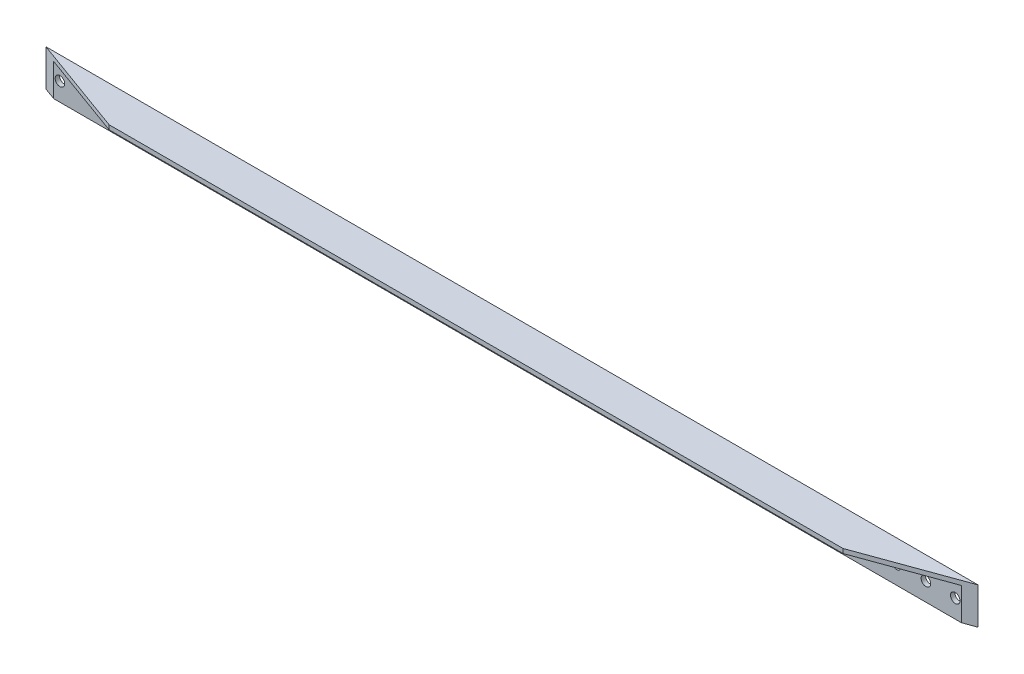
from build123d import *

# Parameters (mm, degrees)
SKETCH_1_W          = 2540
SKETCH_1_H          = 100
SKETCH_1_R          = 13
EXTRUDE_523_DEPTH   = 12
SKETCH_2_W          = 2540
SKETCH_2_H          = 12
EXTRUDE_1_DEPTH     = 86
CUT_EXTRUDE_1_DEPTH = 1278.694799238


with BuildPart() as part:
    # 草图1 → Extrude 523 (new body)
    with BuildSketch(Plane.XY):
        Rectangle(SKETCH_1_W, SKETCH_1_H)
        with Locations((1220, 0)):
            Circle(SKETCH_1_R, mode=Mode.SUBTRACT)
        with Locations((1140, 0)):
            Circle(SKETCH_1_R, mode=Mode.SUBTRACT)
        with Locations((1060, 0)):
            Circle(SKETCH_1_R, mode=Mode.SUBTRACT)
        with Locations((980, 0)):
            Circle(SKETCH_1_R, mode=Mode.SUBTRACT)
        with Locations((580, 0)):
            Circle(SKETCH_1_R, mode=Mode.SUBTRACT)
        with Locations((460, 0)):
            Circle(SKETCH_1_R, mode=Mode.SUBTRACT)
        with Locations((380, 0)):
            Circle(SKETCH_1_R, mode=Mode.SUBTRACT)
        with Locations((300, 0)):
            Circle(SKETCH_1_R, mode=Mode.SUBTRACT)
        with Locations((180, 0)):
            Circle(SKETCH_1_R, mode=Mode.SUBTRACT)
        with Locations(Location((-180, 0, 0), (0, 0, 180))):
            Circle(SKETCH_1_R, mode=Mode.SUBTRACT)
        with Locations(Location((-300, 0, 0), (0, 0, 180))):
            Circle(SKETCH_1_R, mode=Mode.SUBTRACT)
        with Locations(Location((-380, 0, 0), (0, 0, 180))):
            Circle(SKETCH_1_R, mode=Mode.SUBTRACT)
        with Locations(Location((-460, 0, 0), (0, 0, 180))):
            Circle(SKETCH_1_R, mode=Mode.SUBTRACT)
        with Locations(Location((-580, 0, 0), (0, 0, 180))):
            Circle(SKETCH_1_R, mode=Mode.SUBTRACT)
        with Locations(Location((-980, 0, 0), (0, 0, 180))):
            Circle(SKETCH_1_R, mode=Mode.SUBTRACT)
        with Locations(Location((-1060, 0, 0), (0, 0, 180))):
            Circle(SKETCH_1_R, mode=Mode.SUBTRACT)
        with Locations(Location((-1140, 0, 0), (0, 0, 180))):
            Circle(SKETCH_1_R, mode=Mode.SUBTRACT)
        with Locations(Location((-1220, 0, 0), (0, 0, 180))):
            Circle(SKETCH_1_R, mode=Mode.SUBTRACT)
    extrude(amount=EXTRUDE_523_DEPTH)

    # 草图2 → 凸台-拉伸1 (add)
    with BuildSketch(Plane.XY.offset(12)):
        with Locations((0, 44)):
            Rectangle(SKETCH_2_W, SKETCH_2_H)
    extrude(amount=EXTRUDE_1_DEPTH)

    # 草图4 → 切除-拉伸1 (cut, through all)
    with BuildSketch(Plane(origin=(0, 50, 0), x_dir=(-1, 0, 0), z_dir=(0, 1, 0))):
        Polygon((-1270, 0), (-1270, 98), (-1000, 98), align=None)
        Polygon((1270, 0), (1000, 98), (1270, 98), align=None)
    extrude(amount=-CUT_EXTRUDE_1_DEPTH, mode=Mode.SUBTRACT)


solid = part.part
